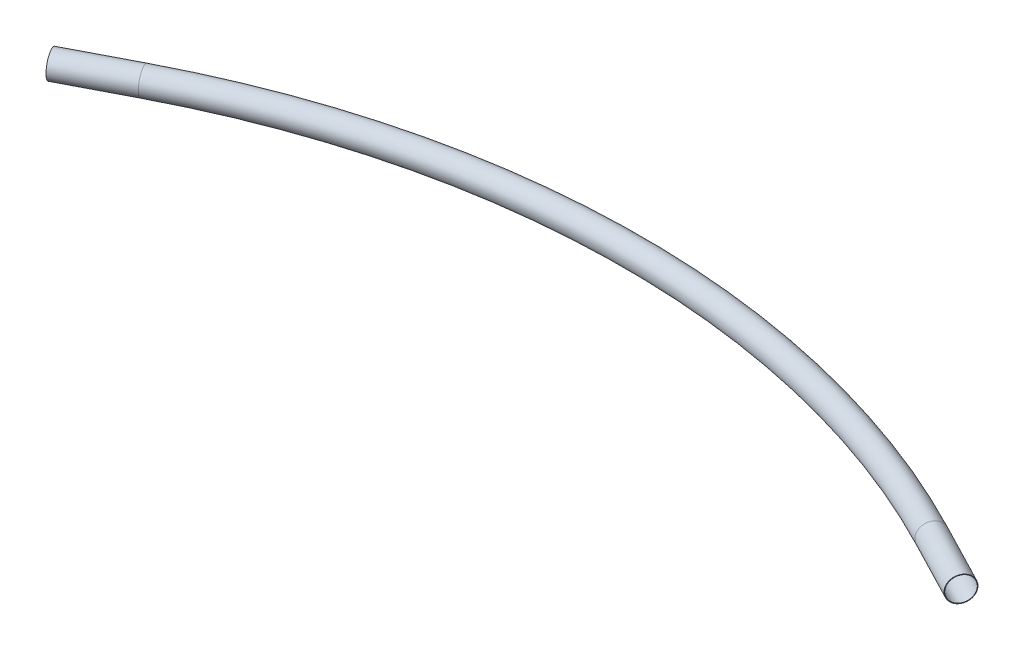
from build123d import *

# Parameters (mm, degrees)
SKETCH12_R                 = 84.1375
SKETCH12_R_2               = 80.7339
STRUCTURAL_MEMBER1_DEPTH   = 457.2
SKETCH12_ON_SEGMENT_2_R    = 84.1375
SKETCH12_ON_SEGMENT_2_R_2  = 80.7339
STRUCTURAL_MEMBER1_2_ANGLE = 54.80873932
SKETCH12_ON_SEGMENT_3_R    = 84.1375
SKETCH12_ON_SEGMENT_3_R_2  = 80.7339
STRUCTURAL_MEMBER1_3_DEPTH = 457.2


with BuildPart() as part:
    # Sketch12 → Structural Member1 (new body)
    with BuildSketch(Plane(origin=(2630.4875, 0, 0), x_dir=(-0.4602674926474758, 0, 0.8877802854377911), z_dir=(-0.8877802854377911, 0, -0.4602674926474758))):
        Circle(SKETCH12_R)
        Circle(SKETCH12_R_2, mode=Mode.SUBTRACT)
    extrude(amount=-STRUCTURAL_MEMBER1_DEPTH)


with BuildPart() as body_2:
    # Sketch12 on segment 2 (carried to the start of arc 2) → Structural Member1 2 (revolve)
    with BuildSketch(Plane(origin=(2630.4875, 0, 0), x_dir=(0.460267493, 0, -0.887780285), z_dir=(0.887780285, 0, 0.460267493))):
        Circle(SKETCH12_ON_SEGMENT_2_R)
        Circle(SKETCH12_ON_SEGMENT_2_R_2, mode=Mode.SUBTRACT)
    revolve(axis=Axis((0, 0, 5073.777707302), (0, 1, 0)), revolution_arc=STRUCTURAL_MEMBER1_2_ANGLE)


with BuildPart() as body_3:
    # Sketch12 on segment 3 (carried to segment 3) → Structural Member1 3 (new body)
    with BuildSketch(Plane(origin=(-3036.380646502, 0, 210.434297638), x_dir=(-0.460267493, 0, -0.887780285), z_dir=(0.887780285, 0, -0.460267493))):
        Circle(SKETCH12_ON_SEGMENT_3_R)
        Circle(SKETCH12_ON_SEGMENT_3_R_2, mode=Mode.SUBTRACT)
    extrude(amount=STRUCTURAL_MEMBER1_3_DEPTH)


solid = Compound([part.part, body_2.part, body_3.part])
